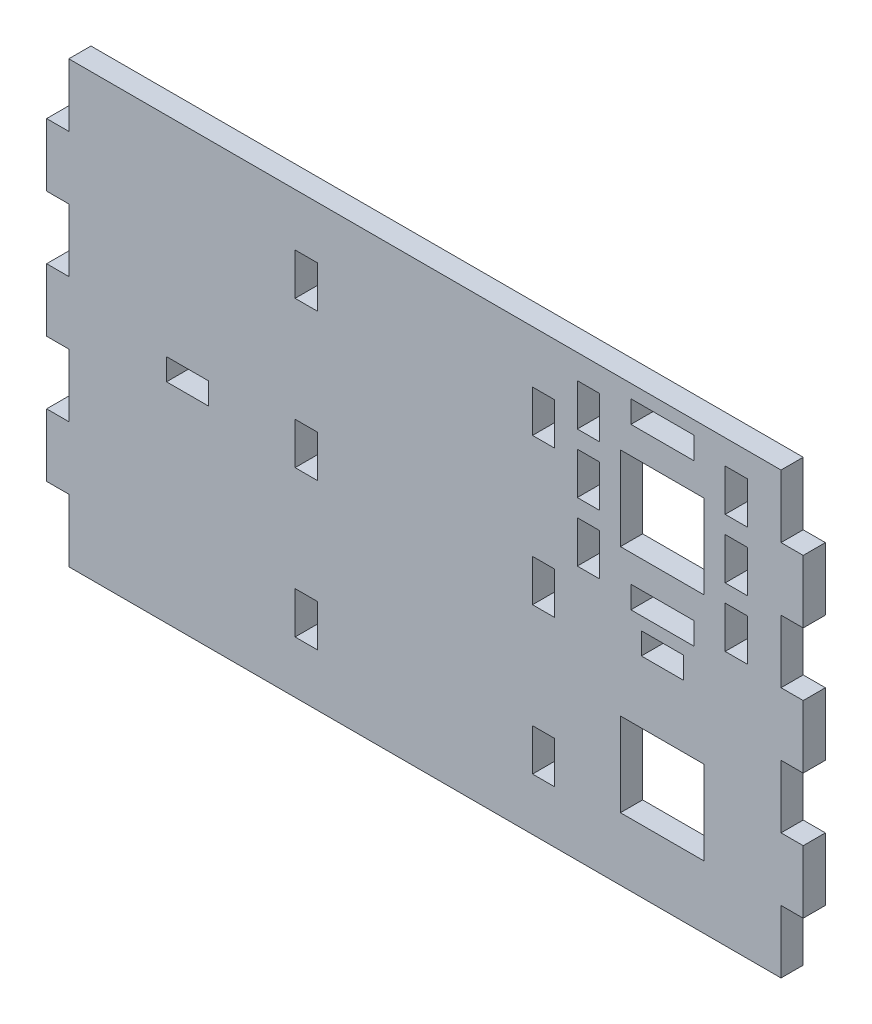
from build123d import *

# Parameters (mm, degrees)
SKETCH1_W           = 6
SKETCH1_H           = 3.125
SKETCH1_W_2         = 9
SKETCH1_H_2         = 3.175
SKETCH1_W_3         = 12
SKETCH1_H_3         = 12
SKETCH1_W_4         = 3.175
SKETCH1_H_4         = 6
BOSS_EXTRUDE1_DEPTH = 1.5875


with BuildPart() as part:
    # Sketch1 → Boss-Extrude1 (new, symmetric)
    with BuildSketch(Plane.XY):
        Polygon((54.175, 4.5), (51, 4.5), (51, 13.5), (54.175, 13.5), (54.175, 22.5), (51, 22.5), (51, 31.5), (-51, 31.5), (-51, 22.5), (-54.175, 22.5), (-54.175, 13.5), (-51, 13.5), (-51, 4.5), (-54.175, 4.5), (-54.175, -4.5), (-51, -4.5), (-51, -13.5), (-54.175, -13.5), (-54.175, -22.5), (-51, -22.5), (-51, -31.5), (51, -31.5), (51, -22.5), (54.175, -22.5), (54.175, -13.5), (51, -13.5), (51, -4.5), (54.175, -4.5), align=None)
        with Locations((34, 0)):
            Rectangle(SKETCH1_W, SKETCH1_H, mode=Mode.SUBTRACT)
        with Locations((34, 5)):
            Rectangle(SKETCH1_W_2, SKETCH1_H_2, mode=Mode.SUBTRACT)
        with Locations((34, 16.5)):
            Rectangle(SKETCH1_W_3, SKETCH1_H_3, mode=Mode.SUBTRACT)
        with Locations((34, 28)):
            Rectangle(SKETCH1_W_2, SKETCH1_H_2, mode=Mode.SUBTRACT)
        with Locations((44.5875, 8)):
            Rectangle(SKETCH1_W_4, SKETCH1_H_4, mode=Mode.SUBTRACT)
        with Locations((44.5875, 16.5)):
            Rectangle(SKETCH1_W_4, SKETCH1_H_4, mode=Mode.SUBTRACT)
        with Locations((44.5875, 25)):
            Rectangle(SKETCH1_W_4, SKETCH1_H_4, mode=Mode.SUBTRACT)
        with Locations((34, -16.5)):
            Rectangle(SKETCH1_W_3, SKETCH1_H_3, mode=Mode.SUBTRACT)
        with Locations((17, 21)):
            Rectangle(SKETCH1_W_4, SKETCH1_H_4, mode=Mode.SUBTRACT)
        with Locations((23.4125, 25)):
            Rectangle(SKETCH1_W_4, SKETCH1_H_4, mode=Mode.SUBTRACT)
        with Locations((-17, -21)):
            Rectangle(SKETCH1_W_4, SKETCH1_H_4, mode=Mode.SUBTRACT)
        with Locations((17, -21)):
            Rectangle(SKETCH1_W_4, SKETCH1_H_4, mode=Mode.SUBTRACT)
        with Locations((-34, 0)):
            Rectangle(SKETCH1_W, SKETCH1_H, mode=Mode.SUBTRACT)
        with Locations((-17, 0)):
            Rectangle(SKETCH1_W_4, SKETCH1_H_4, mode=Mode.SUBTRACT)
        with Locations((-17, 21)):
            Rectangle(SKETCH1_W_4, SKETCH1_H_4, mode=Mode.SUBTRACT)
        with Locations((17, 0)):
            Rectangle(SKETCH1_W_4, SKETCH1_H_4, mode=Mode.SUBTRACT)
        with Locations((23.4125, 8)):
            Rectangle(SKETCH1_W_4, SKETCH1_H_4, mode=Mode.SUBTRACT)
        with Locations((23.4125, 16.5)):
            Rectangle(SKETCH1_W_4, SKETCH1_H_4, mode=Mode.SUBTRACT)
    extrude(amount=BOSS_EXTRUDE1_DEPTH, both=True)


solid = part.part
